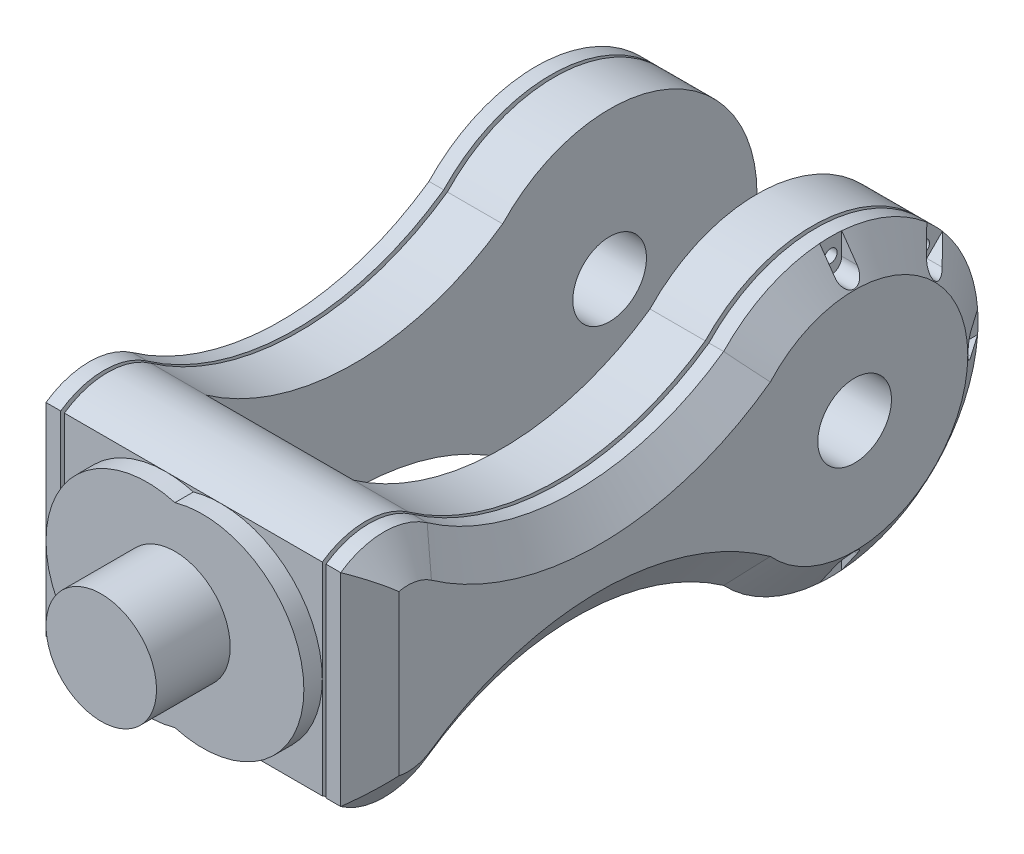
from build123d import *

# Parameters (mm, degrees)
SKETCH1_R                       = 27.5
BOSS_EXTRUDE1_DEPTH             = 5
BOSS_EXTRUDE2_DEPTH             = 15
BOSS_EXTRUDE3_DEPTH             = 1
BOSS_EXTRUDE4_DEPTH             = 4
BOSS_EXTRUDE5_DEPTH             = 6.5
BOSS_EXTRUDE5_DRAFT             = 55
CUT_EXTRUDE1_DEPTH              = 6.5
SKETCH8_R                       = 1.75
CUT_EXTRUDE2_DEPTH              = 5
CIRPATTERN2_COUNT               = 3
CIRPATTERN2_ANGLE               = 90
CIRPATTERN2_THE_OTHER_WAY_COUNT = 3
CIRPATTERN2_THE_OTHER_WAY_ANGLE = 90
BOSS_EXTRUDE6_DEPTH             = 40
SKETCH10_R                      = 15
BOSS_EXTRUDE7_DEPTH             = 20
SKETCH11_R                      = 10
CUT_EXTRUDE3_DEPTH              = 201.444506082


with BuildPart() as part:
    # Sketch1 → Boss-Extrude1 (new body)
    with BuildSketch(Plane.XY):
        Circle(SKETCH1_R)
    extrude(amount=BOSS_EXTRUDE1_DEPTH)



with BuildPart() as body_2:
    # Sketch2 → Boss-Extrude2 (new body)
    with BuildSketch(Plane(origin=(27.5, 0, 0), x_dir=(0, 0, -1), z_dir=(1, 0, 0))):
        with BuildLine():
            Line((0, 27.5), (0, -27.5))
            ThreePointArc((0, -27.5), (11.73149211, -31.209558811), (23.46298422, -27.5))
            ThreePointArc((23.46298422, -27.5), (63.707804562, -14.774378527), (103.952624903, -27.5))
            ThreePointArc((103.952624903, -27.5), (173, 0), (103.952624903, 27.5))
            ThreePointArc((103.952624903, 27.5), (63.707804562, 14.774378527), (23.46298422, 27.5))
            ThreePointArc((23.46298422, 27.5), (11.73149211, 31.209558811), (0, 27.5))
        make_face()
    extrude(amount=BOSS_EXTRUDE2_DEPTH)

    # Sketch3 → Boss-Extrude3 (add)
    with BuildSketch(Plane(origin=(42.5, 0, 0), x_dir=(0, 0, -1), z_dir=(1, 0, 0))):
        with BuildLine():
            Line((2.5, 26.146322422), (2.5, -26.146322422))
            ThreePointArc((2.5, -26.146322422), (12.365514261, -28.698329959), (22.025669208, -25.454486481))
            ThreePointArc((22.025669208, -25.454486481), (63.836511852, -12.274492772), (105.600294855, -25.602854489))
            ThreePointArc((105.600294855, -25.602854489), (170.5, 0), (105.600294855, 25.602854489))
            ThreePointArc((105.600294855, 25.602854489), (63.836511852, 12.274492772), (22.025669208, 25.454486481))
            ThreePointArc((22.025669208, 25.454486481), (12.365514261, 28.698329959), (2.5, 26.146322422))
        make_face()
    extrude(amount=BOSS_EXTRUDE3_DEPTH)

    # Sketch4 → Boss-Extrude4 (add)
    with BuildSketch(Plane(origin=(43.5, 0, 0), x_dir=(0, 0, -1), z_dir=(1, 0, 0))):
        with BuildLine():
            Line((0, 27.5), (0, -27.5))
            ThreePointArc((0, -27.5), (11.73149211, -31.209558811), (23.46298422, -27.5))
            ThreePointArc((23.46298422, -27.5), (63.707804562, -14.774378527), (103.952624903, -27.5))
            ThreePointArc((103.952624903, -27.5), (173, 0), (103.952624903, 27.5))
            ThreePointArc((103.952624903, 27.5), (63.707804562, 14.774378527), (23.46298422, 27.5))
            ThreePointArc((23.46298422, 27.5), (11.73149211, 31.209558811), (0, 27.5))
        make_face()
    extrude(amount=BOSS_EXTRUDE4_DEPTH)


with BuildPart() as boss_extrude5_tool:
    # Sketch6 → Boss-Extrude5 (with draft: the straight prism first)
    with BuildSketch(Plane(origin=(47.5, 0, 0), x_dir=(0, 0, -1), z_dir=(1, 0, 0))):
        with BuildLine():
            Line((0, 27.5), (0, -27.5))
            ThreePointArc((0, -27.5), (11.73149211, -31.209558811), (23.46298422, -27.5))
            ThreePointArc((23.46298422, -27.5), (63.707804562, -14.774378527), (103.952624903, -27.5))
            ThreePointArc((103.952624903, -27.5), (173, 0), (103.952624903, 27.5))
            ThreePointArc((103.952624903, 27.5), (63.707804562, 14.774378527), (23.46298422, 27.5))
            ThreePointArc((23.46298422, 27.5), (11.73149211, 31.209558811), (0, 27.5))
        make_face()
    extrude(amount=BOSS_EXTRUDE5_DEPTH)
    # Boss-Extrude5: the draft: its side faces are tilted about the plane it starts from
    boss_extrude5_sides = [boss_extrude5_tool.faces().sort_by_distance(p)[0] for p in [
        (50.75, 31.209558811, -11.73149211),
        (50.75, 0, 0),
        (50.75, -31.209558811, -11.73149211),
        (50.75, -14.774378527, -63.707804562),
        (50.75, 0, -173),
        (50.75, 14.774378527, -63.707804562),
    ]]
    draft(boss_extrude5_sides, Plane(origin=(47.5, 0, 0), x_dir=(0, 0, -1), z_dir=(1, 0, 0)), BOSS_EXTRUDE5_DRAFT)


with BuildPart() as body_2_1:
    add(body_2.part)

    # Boss-Extrude5: add boss_extrude5_tool
    add(boss_extrude5_tool.part)

    # Sketch7 → Cut-Extrude1 (cut)
    with BuildSketch(Plane(origin=(54, 0, 0), x_dir=(0, 0, -1), z_dir=(1, 0, 0))):
        with BuildLine():
            Line((166.88734135, 3), (172.88734135, 3))
            ThreePointArc((172.88734135, 3), (173.88734135, 0), (172.88734135, -3))
            Line((172.88734135, -3), (166.88734135, -3))
            ThreePointArc((166.88734135, -3), (163.88734135, 0), (166.88734135, 3))
        make_face()
    cut_extrude1 = extrude(amount=-CUT_EXTRUDE1_DEPTH, mode=Mode.SUBTRACT)

    # Sketch8 → Cut-Extrude2 (cut)
    with BuildSketch(Plane(origin=(47.5, 0, 0), x_dir=(0, 0, -1), z_dir=(1, 0, 0))):
        with Locations((168.443670675, 0)):
            Circle(SKETCH8_R)
    cut_extrude2 = extrude(amount=-CUT_EXTRUDE2_DEPTH, mode=Mode.SUBTRACT)

    # CirPattern2: Cut-Extrude1, Cut-Extrude2 ×3 about axis
    cirpattern2_axis = Axis((0, 0, -133), (1, 0, 0))
    add([cut_extrude1.rotate(cirpattern2_axis, i * CIRPATTERN2_ANGLE / (CIRPATTERN2_COUNT - 1)) for i in range(1, CIRPATTERN2_COUNT)], mode=Mode.SUBTRACT)
    add([cut_extrude2.rotate(cirpattern2_axis, i * CIRPATTERN2_ANGLE / (CIRPATTERN2_COUNT - 1)) for i in range(1, CIRPATTERN2_COUNT)], mode=Mode.SUBTRACT)

    # CirPattern2 the other way: Cut-Extrude1, Cut-Extrude2 ×3 about axis
    cirpattern2_the_other_way_axis = Axis((0, 0, -133), (-1, 0, 0))
    add([cut_extrude1.rotate(cirpattern2_the_other_way_axis, i * CIRPATTERN2_THE_OTHER_WAY_ANGLE / (CIRPATTERN2_THE_OTHER_WAY_COUNT - 1)) for i in range(1, CIRPATTERN2_THE_OTHER_WAY_COUNT)], mode=Mode.SUBTRACT)
    add([cut_extrude2.rotate(cirpattern2_the_other_way_axis, i * CIRPATTERN2_THE_OTHER_WAY_ANGLE / (CIRPATTERN2_THE_OTHER_WAY_COUNT - 1)) for i in range(1, CIRPATTERN2_THE_OTHER_WAY_COUNT)], mode=Mode.SUBTRACT)


with BuildPart() as part_1:
    add(part.part)

    add(body_2_1.part)  # Boss-Extrude6 merges body 2
    # Sketch9 → Boss-Extrude6 (add)
    with BuildSketch(Plane.ZY.offset(-27.5)):
        with BuildLine():
            Line((-23.46298422, 27.5), (-23.46298422, -27.5))
            ThreePointArc((-23.46298422, -27.5), (-11.73149211, -31.209558811), (0, -27.5))
            Line((0, -27.5), (0, 27.5))
            ThreePointArc((0, 27.5), (-11.73149211, 31.209558811), (-23.46298422, 27.5))
        make_face()
    extrude(amount=BOSS_EXTRUDE6_DEPTH)

    # Mirror3: part across plane


with BuildPart() as part_2:
    add(part_1.part)
    add(part_1.part.mirror(Plane.ZY.offset(-7.5)))

    # Sketch10 → Boss-Extrude7 (add)
    with BuildSketch(Plane.XY.offset(5)):
        with Locations((7.5, 0)):
            Circle(SKETCH10_R)
    extrude(amount=BOSS_EXTRUDE7_DEPTH)

    # Sketch11 → Cut-Extrude3 (cut, through all)
    with BuildSketch(Plane.ZY.offset(39)):
        with Locations((-133, 0)):
            Circle(SKETCH11_R)
    extrude(amount=-CUT_EXTRUDE3_DEPTH, mode=Mode.SUBTRACT)


solid = part_2.part
